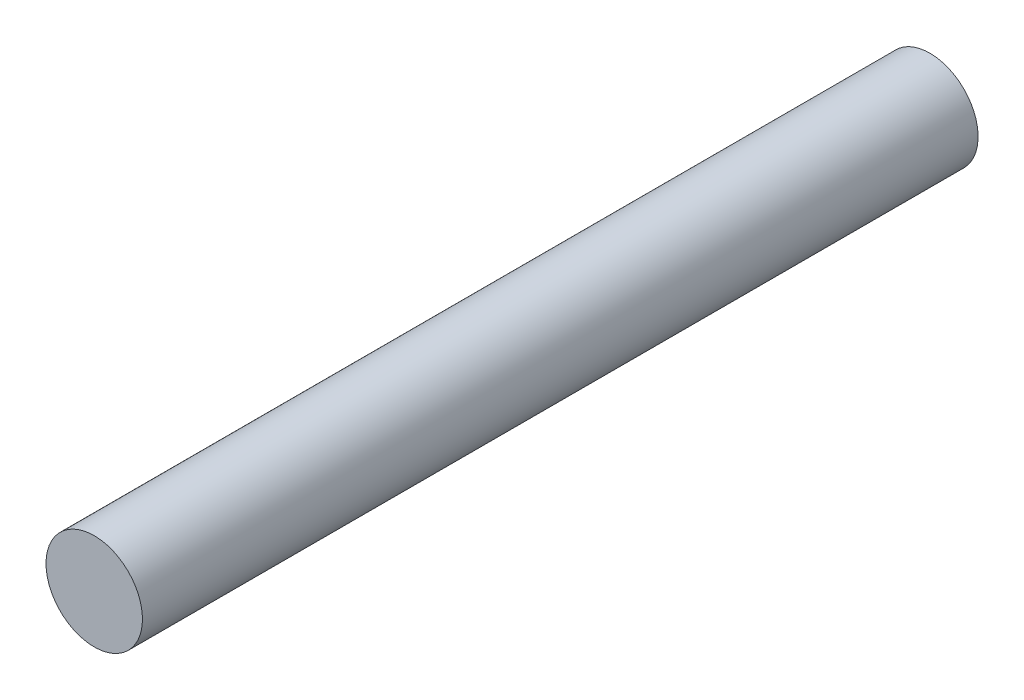
from build123d import *

# Parameters (mm, degrees)
SKETCH1_R           = 1.5
BOSS_EXTRUDE1_DEPTH = 26


with BuildPart() as part:
    # Sketch1 → Boss-Extrude1 (new body)
    with BuildSketch(Plane.XY):
        with Locations(Location((0, 0, 0), (0, 0, 180))):
            Circle(SKETCH1_R)
    extrude(amount=BOSS_EXTRUDE1_DEPTH)


solid = part.part
